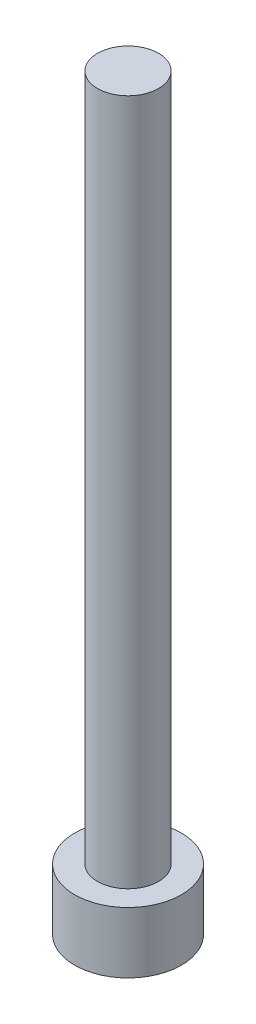
from build123d import *

# Parameters (mm, degrees)
SKETCH_1_R      = 2
EXTRUDE_1_DEPTH = 45
SKETCH_2_R      = 3.5
EXTRUDE_2_DEPTH = 4


with BuildPart() as part:
    # 草图1 → 凸台-拉伸1 (new body)
    with BuildSketch(Plane(origin=(0, 0, 0), x_dir=(1, 0, 0), z_dir=(0, 1, 0))):
        with Locations(Location((0, 0, 0), (0, 0, 90))):
            Circle(SKETCH_1_R)
    extrude(amount=EXTRUDE_1_DEPTH)

    # 草图2 → 凸台-拉伸2 (add)
    with BuildSketch(Plane.XZ):
        with Locations(Location((0, 0, 0), (0, 0, 270))):
            Circle(SKETCH_2_R)
    extrude(amount=EXTRUDE_2_DEPTH)


solid = part.part
